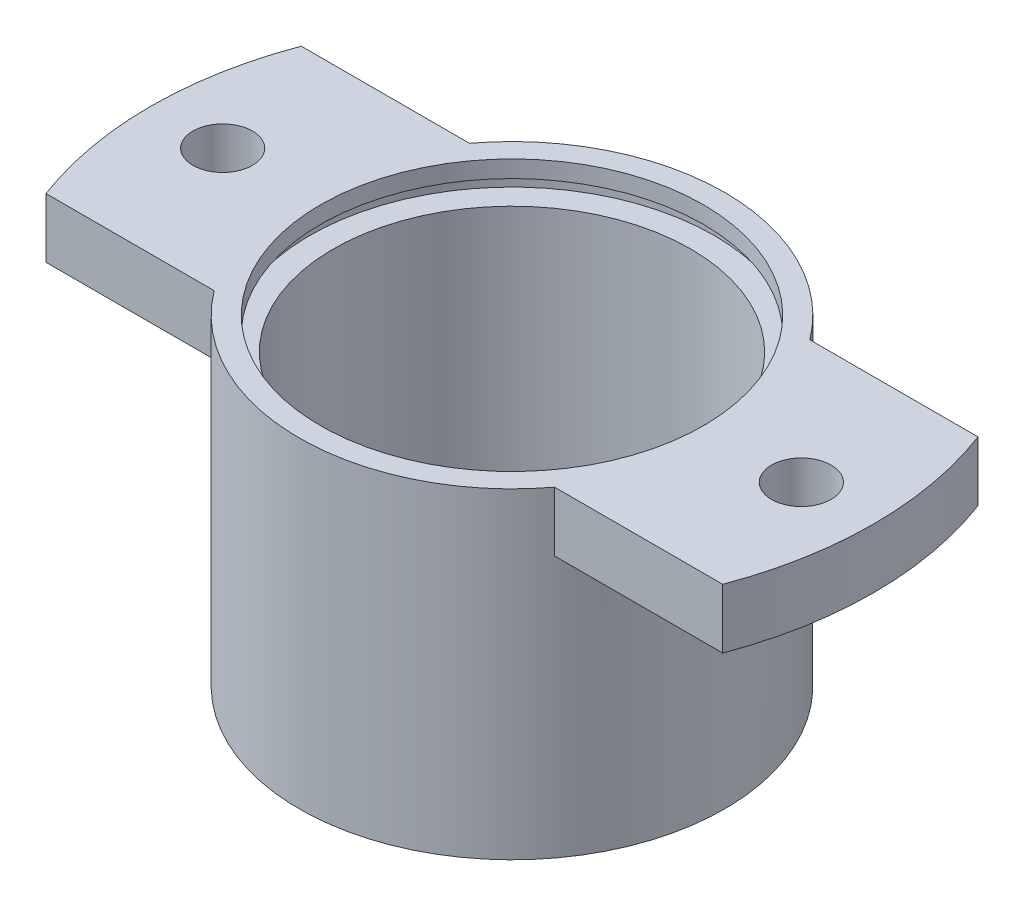
from build123d import *

# Parameters (mm, degrees)
BOSS_EXTRUDE2_START = -7
BOSS_EXTRUDE2_DEPTH = 7
SKETCH8_R           = 3.5
CUT_EXTRUDE2_DEPTH  = 7


with BuildPart() as part:
    # Sketch4 → Revolve1 (revolve)
    with BuildSketch(Plane(origin=(0, 0, 0), x_dir=(0, 0, -1), z_dir=(1, 0, 0)), mode=Mode.PRIVATE) as revolve1_sk:
        Polygon((-25, 37.75), (-25, 0), (-18, 0), (-18, 2), (-21, 2), (-21, 34), (-23.75, 34), (-23.75, 35.75), (-22.5, 35.75), (-22.5, 37.75), align=None)
    revolve(revolve1_sk.sketch.rotate(Axis((0, -1.117924861, 0), (0, 1, 0)), 180), axis=Axis((0, -1.117924861, 0), (0, 1, 0)))

    # Sketch7 → Boss-Extrude2 (add)
    with BuildSketch(Plane(origin=(0, 37.75, 0), x_dir=(1, 0, 0), z_dir=(0, 1, 0)).offset(BOSS_EXTRUDE2_START)):
        with BuildLine():
            Line((-39.764934301, -15), (-20, -15))
            ThreePointArc((-20, -15), (-25, 0), (-20, 15))
            Line((-20, 15), (-39.764934301, 15))
            ThreePointArc((-39.764934301, 15), (-42.5, 0), (-39.764934301, -15))
        make_face()
        with BuildLine():
            Line((39.764934301, 15), (20, 15))
            ThreePointArc((20, 15), (25, 0), (20, -15))
            Line((20, -15), (39.764934301, -15))
            ThreePointArc((39.764934301, -15), (42.5, 0), (39.764934301, 15))
        make_face()
    extrude(amount=BOSS_EXTRUDE2_DEPTH)

    # Sketch8 → Cut-Extrude2 (cut)
    with BuildSketch(Plane(origin=(0, 37.75, 0), x_dir=(1, 0, 0), z_dir=(0, 1, 0))):
        with Locations(Location((34, 0, 0), (0, 0, 270))):
            Circle(SKETCH8_R)
        with Locations(Location((-34, 0, 0), (0, 0, 270))):
            Circle(SKETCH8_R)
    extrude(amount=-CUT_EXTRUDE2_DEPTH, mode=Mode.SUBTRACT)


solid = part.part
